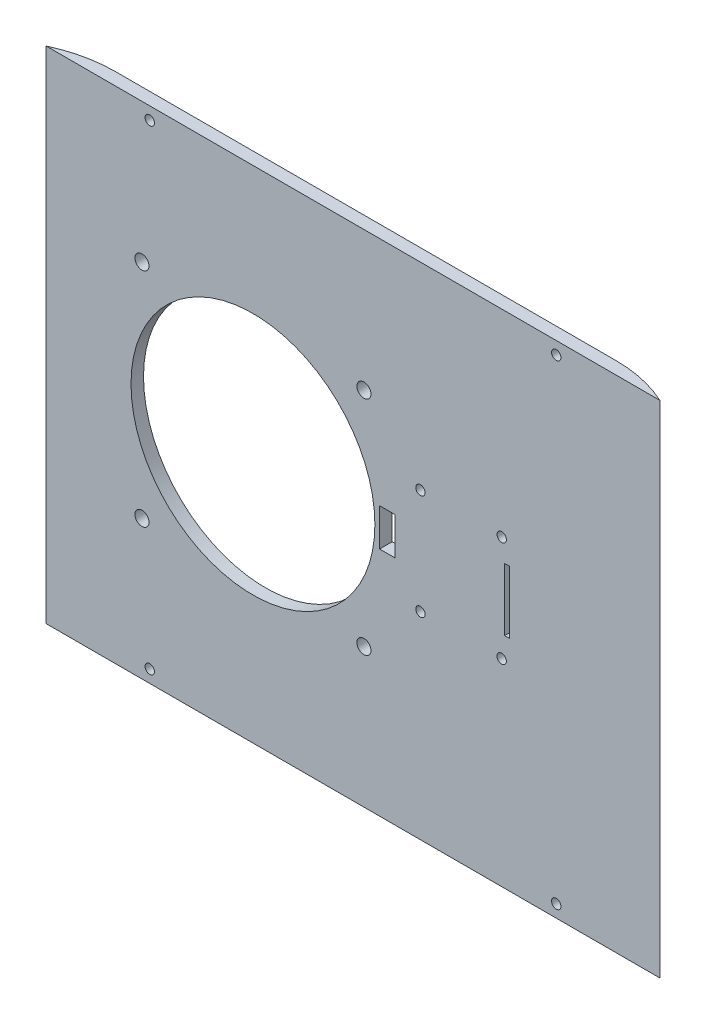
from build123d import *

# Parameters (mm, degrees)
SCHIZZO1_W                   = 160
SCHIZZO1_H                   = 160
SCHIZZO1_R                   = 1.5
ESTRUSIONE_ESTRUSIONE1_DEPTH = 4
SCHIZZO2_R                   = 1.5
SCHIZZO2_W                   = 1.5
SCHIZZO2_H                   = 20
TAGLIO_ESTRUSIONE1_DEPTH     = 36
SCHIZZO3_R                   = 39
SCHIZZO3_R_2                 = 2.25
SCHIZZO3_W                   = 5
SCHIZZO3_H                   = 12
TAGLIO_ESTRUSIONE2_DEPTH     = 7
SCHIZZO4_W                   = 4
SCHIZZO4_H                   = 160
ESTRUSIONE_ESTRUSIONE2_DEPTH = 18.13835714
SCHIZZO5_W                   = 4
SCHIZZO5_H                   = 160
ESTRUSIONE_ESTRUSIONE3_DEPTH = 18.13835714
TAGLIO_ESTRUSIONE3_DEPTH     = 229.13835714


with BuildPart() as part:
    # Schizzo1 → Estrusione-Estrusione1 (new body)
    with BuildSketch(Plane.XY):
        with Locations((-3.483874863, 13.01)):
            Rectangle(SCHIZZO1_W, SCHIZZO1_H)
        with Locations((-68.483874863, 89.01)):
            Circle(SCHIZZO1_R, mode=Mode.SUBTRACT)
        with Locations((61.516125137, 89.01)):
            Circle(SCHIZZO1_R, mode=Mode.SUBTRACT)
        with Locations((-68.483874863, -62.99)):
            Circle(SCHIZZO1_R, mode=Mode.SUBTRACT)
        with Locations((61.516125137, -62.99)):
            Circle(SCHIZZO1_R, mode=Mode.SUBTRACT)
    extrude(amount=ESTRUSIONE_ESTRUSIONE1_DEPTH)

    # Schizzo2 → Taglio-Estrusione1 (cut)
    with BuildSketch(Plane(origin=(0, 0, 0), x_dir=(-1, 0, 0), z_dir=(0, 0, -1))):
        with Locations((-44.071905048, 29.8436475)):
            Circle(SCHIZZO2_R)
        with Locations((-44.071905048, -3.8236475)):
            Circle(SCHIZZO2_R)
        with Locations((-18.082922837, -3.8236475)):
            Circle(SCHIZZO2_R)
        with Locations((-18.082922837, 29.8436475)):
            Circle(SCHIZZO2_R)
        with Locations((-45.766125137, 13.01)):
            Rectangle(SCHIZZO2_W, SCHIZZO2_H)
    extrude(amount=-TAGLIO_ESTRUSIONE1_DEPTH, mode=Mode.SUBTRACT)

    # Schizzo3 → Taglio-Estrusione2 (cut)
    with BuildSketch(Plane(origin=(0, 0, 0), x_dir=(-1, 0, 0), z_dir=(0, 0, -1))):
        with Locations((35.483874863, 13.01)):
            Circle(SCHIZZO3_R)
        with Locations((70.98387486, 48.509999997)):
            Circle(SCHIZZO3_R_2)
        with Locations(Location((70.98387486, -22.489999997, 0), (0, 0, 180))):
            Circle(SCHIZZO3_R_2)
        with Locations(Location((-0.016125134, 48.509999997, 0), (0, 0, 180))):
            Circle(SCHIZZO3_R_2)
        with Locations((-0.016125134, -22.489999997)):
            Circle(SCHIZZO3_R_2)
        with Locations((-7.516125137, 13.01)):
            Rectangle(SCHIZZO3_W, SCHIZZO3_H)
    extrude(amount=-TAGLIO_ESTRUSIONE2_DEPTH, mode=Mode.SUBTRACT)

    # Schizzo4 → Estrusione-Estrusione2 (add)
    with BuildSketch(Plane.ZY.offset(83.483874863)):
        with Locations((2, 13.01)):
            Rectangle(SCHIZZO4_W, SCHIZZO4_H)
    extrude(amount=ESTRUSIONE_ESTRUSIONE2_DEPTH)

    # Schizzo5 → Estrusione-Estrusione3 (add)
    with BuildSketch(Plane(origin=(76.516125137, 0, 0), x_dir=(0, 0, -1), z_dir=(1, 0, 0))):
        with Locations((-2, 13.01)):
            Rectangle(SCHIZZO5_W, SCHIZZO5_H)
    extrude(amount=ESTRUSIONE_ESTRUSIONE3_DEPTH)

    # Schizzo6 → Taglio-Estrusione3 (cut)
    with BuildSketch(Plane(origin=(0, 93.01, 0), x_dir=(1, 0, 0), z_dir=(0, 1, 0))):
        with BuildLine():
            Line((-101.622232003, -4), (-101.622232003, 0))
            Line((-101.622232003, 0), (-83.483874863, 0))
            ThreePointArc((-83.483874863, 0), (-92.77096267, -1.011871109), (-101.622232003, -4))
        make_face()
        with BuildLine():
            Line((76.516125137, 0), (94.654482277, 0))
            Line((94.654482277, 0), (94.654482277, -4))
            ThreePointArc((94.654482277, -4), (85.803212944, -1.011871109), (76.516125137, 0))
        make_face()
    extrude(amount=-TAGLIO_ESTRUSIONE3_DEPTH, mode=Mode.SUBTRACT)


solid = part.part
